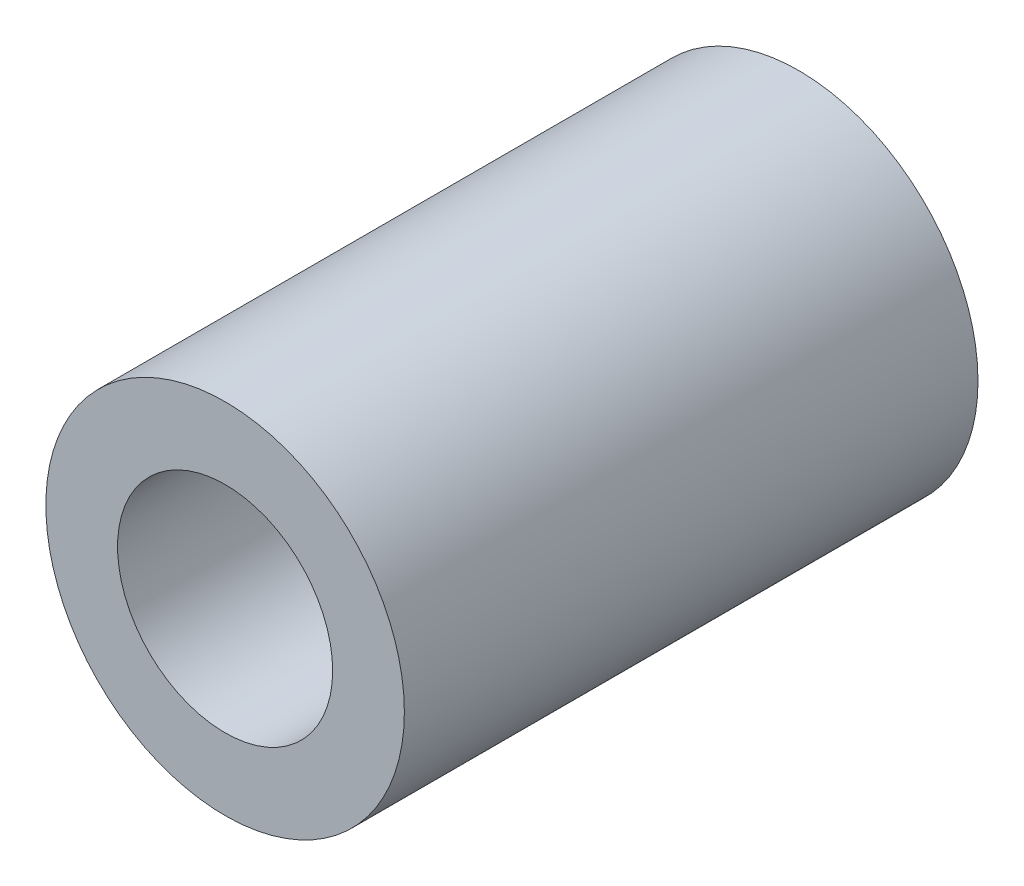
from build123d import *

# Parameters (mm, degrees)
SKETCH1_R           = 3.96875
SKETCH1_R_2         = 2.38125
BOSS_EXTRUDE1_DEPTH = 12.7


with BuildPart() as part:
    # Sketch1 → Boss-Extrude1 (new body)
    with BuildSketch(Plane.XY):
        Circle(SKETCH1_R)
        Circle(SKETCH1_R_2, mode=Mode.SUBTRACT)
    extrude(amount=BOSS_EXTRUDE1_DEPTH)


solid = part.part
